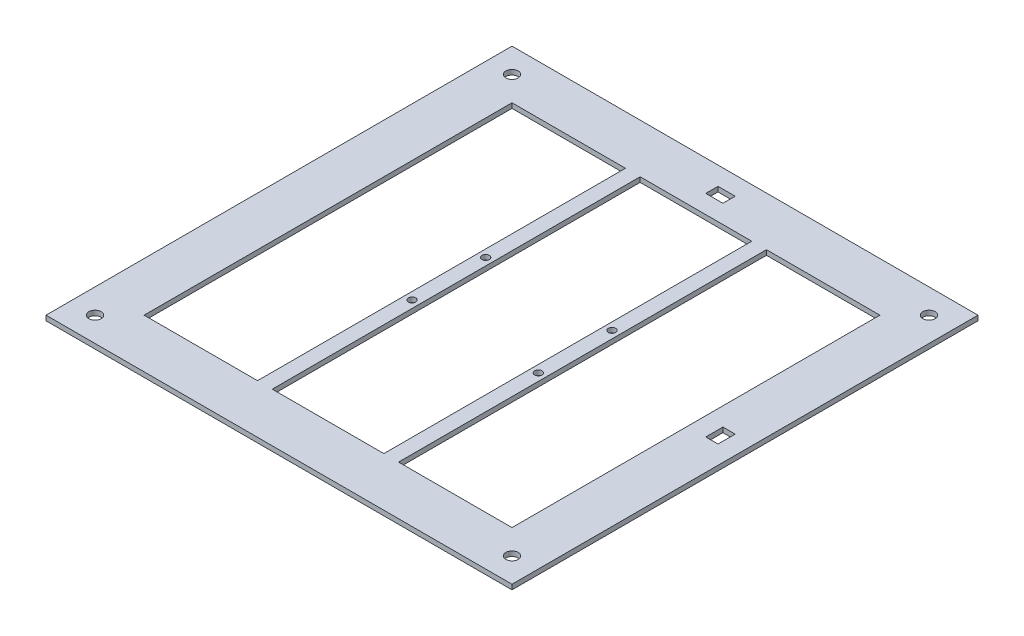
from build123d import *

# Parameters (mm, degrees)
CROQUIS1_W              = 190
CROQUIS1_H              = 190
CROQUIS1_R              = 1.5
CROQUIS1_R_2            = 2.5
CROQUIS1_W_2            = 46.25
CROQUIS1_H_2            = 150
CROQUIS1_W_3            = 45.5
CROQUIS1_W_4            = 5
CROQUIS1_H_3            = 7
CROQUIS1_W_5            = 7
CROQUIS1_H_4            = 5
SALIENTE_EXTRUIR1_DEPTH = 2


with BuildPart() as part:
    # Croquis1 → Saliente-Extruir1 (new body)
    with BuildSketch(Plane(origin=(0, 0, 0), x_dir=(1, 0, 0), z_dir=(0, 1, 0))):
        with Locations((85, 85)):
            Rectangle(CROQUIS1_W, CROQUIS1_H)
        with Locations(Location((59.25, 100, 0), (0, 0, 270))):
            Circle(CROQUIS1_R, mode=Mode.SUBTRACT)
        with Locations(Location((59.25, 70, 0), (0, 0, 270))):
            Circle(CROQUIS1_R, mode=Mode.SUBTRACT)
        with Locations(Location((0, 170, 0), (0, 0, 270))):
            Circle(CROQUIS1_R_2, mode=Mode.SUBTRACT)
        with Locations(Location((0, 0, 0), (0, 0, 270))):
            Circle(CROQUIS1_R_2, mode=Mode.SUBTRACT)
        with Locations(Location((110.75, 100, 0), (0, 0, 90))):
            Circle(CROQUIS1_R, mode=Mode.SUBTRACT)
        with Locations(Location((110.75, 70, 0), (0, 0, 90))):
            Circle(CROQUIS1_R, mode=Mode.SUBTRACT)
        with Locations(Location((170, 0, 0), (0, 0, 90))):
            Circle(CROQUIS1_R_2, mode=Mode.SUBTRACT)
        with Locations(Location((170, 170, 0), (0, 0, 90))):
            Circle(CROQUIS1_R_2, mode=Mode.SUBTRACT)
        with Locations((33.125, 85)):
            Rectangle(CROQUIS1_W_2, CROQUIS1_H_2, mode=Mode.SUBTRACT)
        with Locations((136.875, 85)):
            Rectangle(CROQUIS1_W_2, CROQUIS1_H_2, mode=Mode.SUBTRACT)
        with Locations((85, 85)):
            Rectangle(CROQUIS1_W_3, CROQUIS1_H_2, mode=Mode.SUBTRACT)
        with Locations((170, 85)):
            Rectangle(CROQUIS1_W_4, CROQUIS1_H_3, mode=Mode.SUBTRACT)
        with Locations((85, 170)):
            Rectangle(CROQUIS1_W_5, CROQUIS1_H_4, mode=Mode.SUBTRACT)
    extrude(amount=SALIENTE_EXTRUIR1_DEPTH)


solid = part.part
